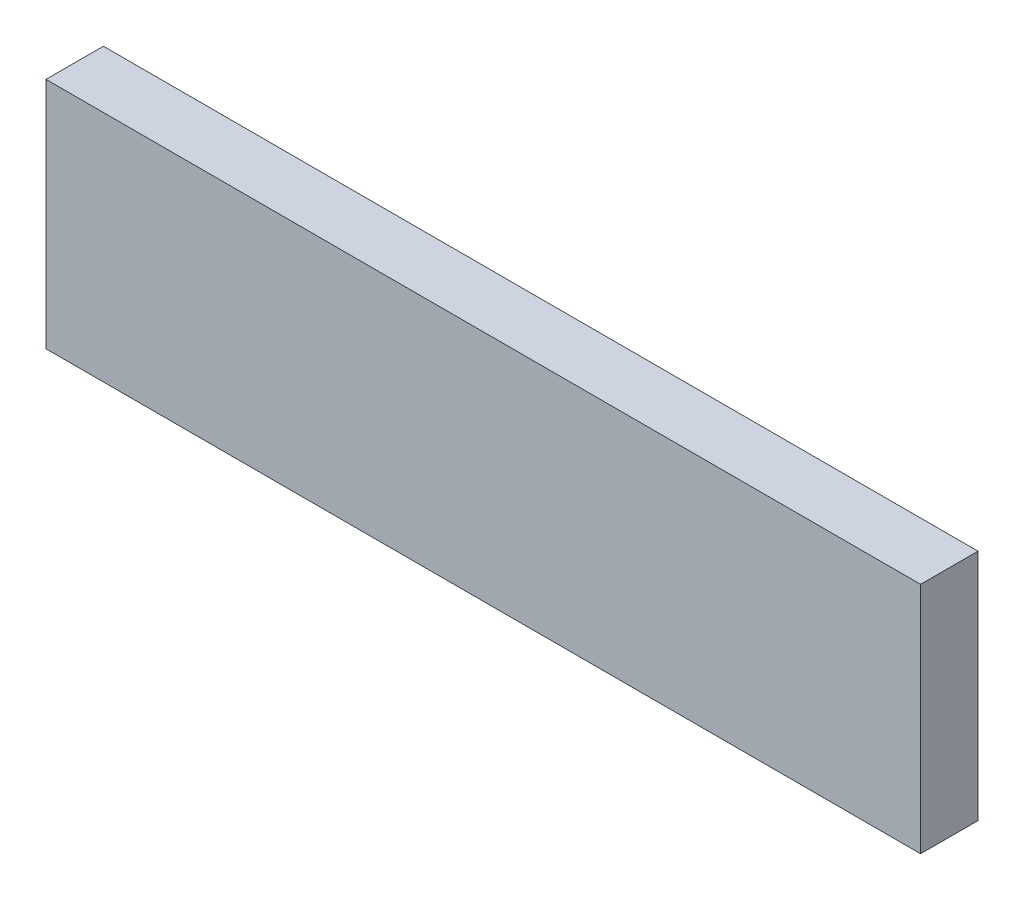
from build123d import *

# Parameters (mm, degrees)
SKETCH1_W           = 2.296924705
SKETCH1_H           = 9.338275878
BOSS_EXTRUDE1_DEPTH = 35


with BuildPart() as part:
    # Sketch1 → Boss-Extrude1 (new body)
    with BuildSketch(Plane(origin=(35, 0, 0), x_dir=(0, 0, -1), z_dir=(1, 0, 0))):
        with Locations((-19.39881223, -37.960924604)):
            Rectangle(SKETCH1_W, SKETCH1_H)
    extrude(amount=BOSS_EXTRUDE1_DEPTH)


solid = part.part
